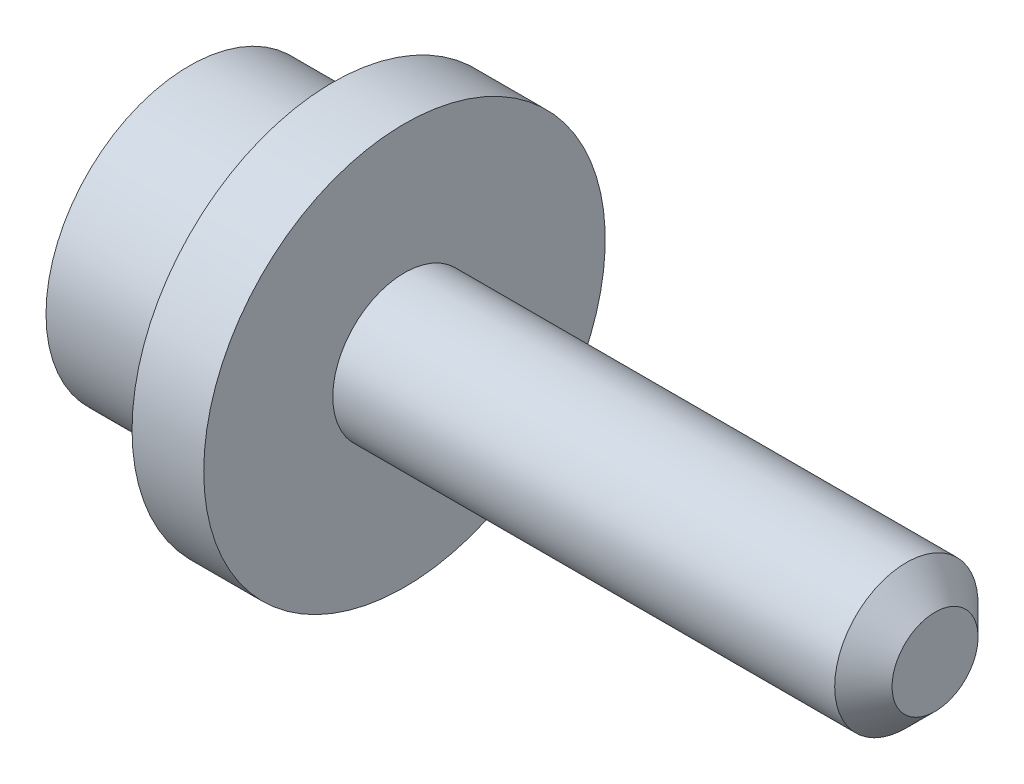
from build123d import *

# Parameters (mm, degrees)
CHANFREIN1_SIZE = 1


with BuildPart() as part:
    # Esquisse1 → Révolution1 (revolve)
    with BuildSketch(Plane.XY, mode=Mode.PRIVATE) as r_volution1_sk:
        Polygon((0, 1.5), (15, 1.5), (15, 0), (26, 0), (26, 2.5), (7.5, 2.5), (7.5, 7), (5, 7), (5, 5), (0, 5), align=None)
    revolve(r_volution1_sk.sketch.rotate(Axis((-19.163170338, 0, 0), (1, 0, 0)), 90), axis=Axis((-19.163170338, 0, 0), (1, 0, 0)))

    # Chanfrein1
    chanfrein1_edges = [part.edges().sort_by_distance(p)[0] for p in [
        (26, 0, -2.5),
    ]]
    chamfer(chanfrein1_edges, length=CHANFREIN1_SIZE)


solid = part.part
